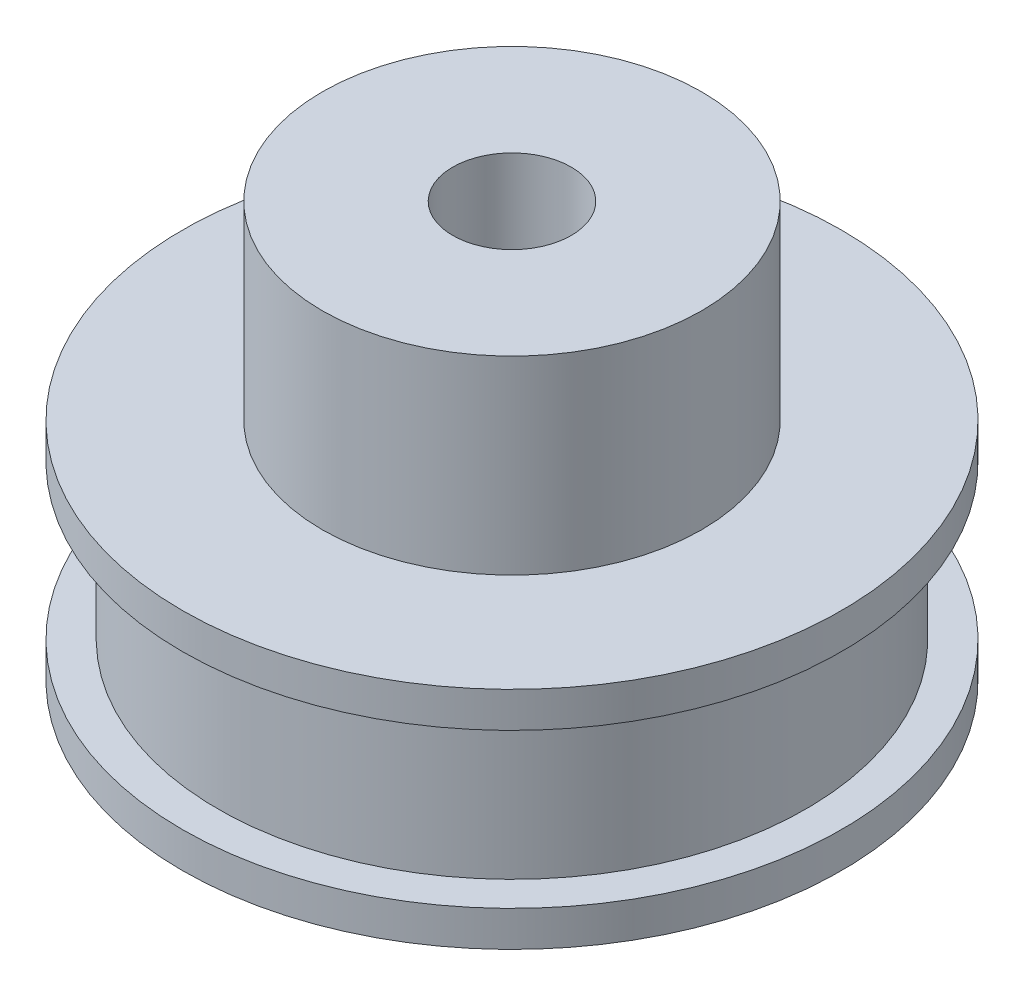
from build123d import *

# Parameters (mm, degrees)
ESQUISSE2_R             = 8.85
ESQUISSE2_R_2           = 8
ENL_V_MAT_EXTRU_1_DEPTH = 8


with BuildPart() as part:
    # Esquisse1 → Révolution1 (revolve)
    with BuildSketch(Plane.XY, mode=Mode.PRIVATE) as r_volution1_sk:
        Polygon((2.5, 0), (13.9, 0), (13.9, 1.5), (12.4, 1.5), (12.4, 8), (13.9, 8), (13.9, 9.5), (8.85, 9.5), (8.85, 17.5), (2.5, 17.5), align=None)
    revolve(r_volution1_sk.sketch.rotate(Axis((0, 0, 0), (0, 1, 0)), 90), axis=Axis((0, 0, 0), (0, 1, 0)))

    # Esquisse2 → Enlèv. mat.-Extru.1 (cut)
    with BuildSketch(Plane(origin=(0, 17.5, 0), x_dir=(1, 0, 0), z_dir=(0, 1, 0))):
        Circle(ESQUISSE2_R)
        with Locations(Location((0, 0, 0), (0, 0, 270))):
            Circle(ESQUISSE2_R_2, mode=Mode.SUBTRACT)
    extrude(amount=-ENL_V_MAT_EXTRU_1_DEPTH, mode=Mode.SUBTRACT)


solid = part.part
